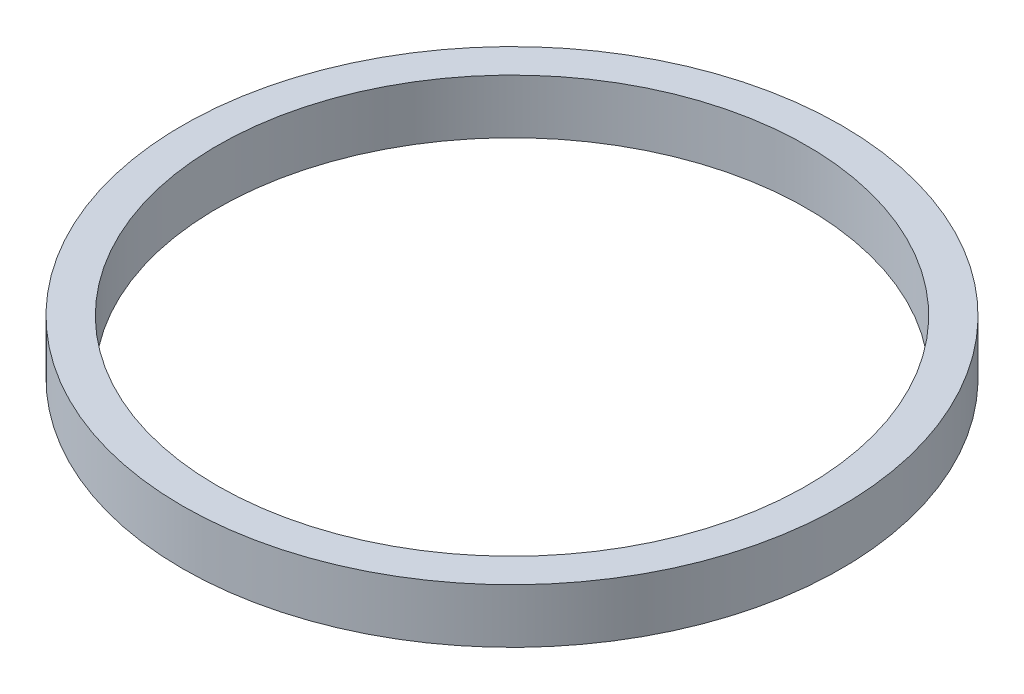
from build123d import *

# Parameters (mm, degrees)
SKETCH1_R           = 42.5
SKETCH1_R_2         = 38
BOSS_EXTRUDE1_DEPTH = 7


with BuildPart() as part:
    # Sketch1 → Boss-Extrude1 (new body)
    with BuildSketch(Plane(origin=(0, 0, 0), x_dir=(1, 0, 0), z_dir=(0, 1, 0))):
        with Locations(Location((0, 0, 0), (0, 0, 270))):
            Circle(SKETCH1_R)
        with Locations(Location((0, 0, 0), (0, 0, 270))):
            Circle(SKETCH1_R_2, mode=Mode.SUBTRACT)
    extrude(amount=BOSS_EXTRUDE1_DEPTH)


solid = part.part
